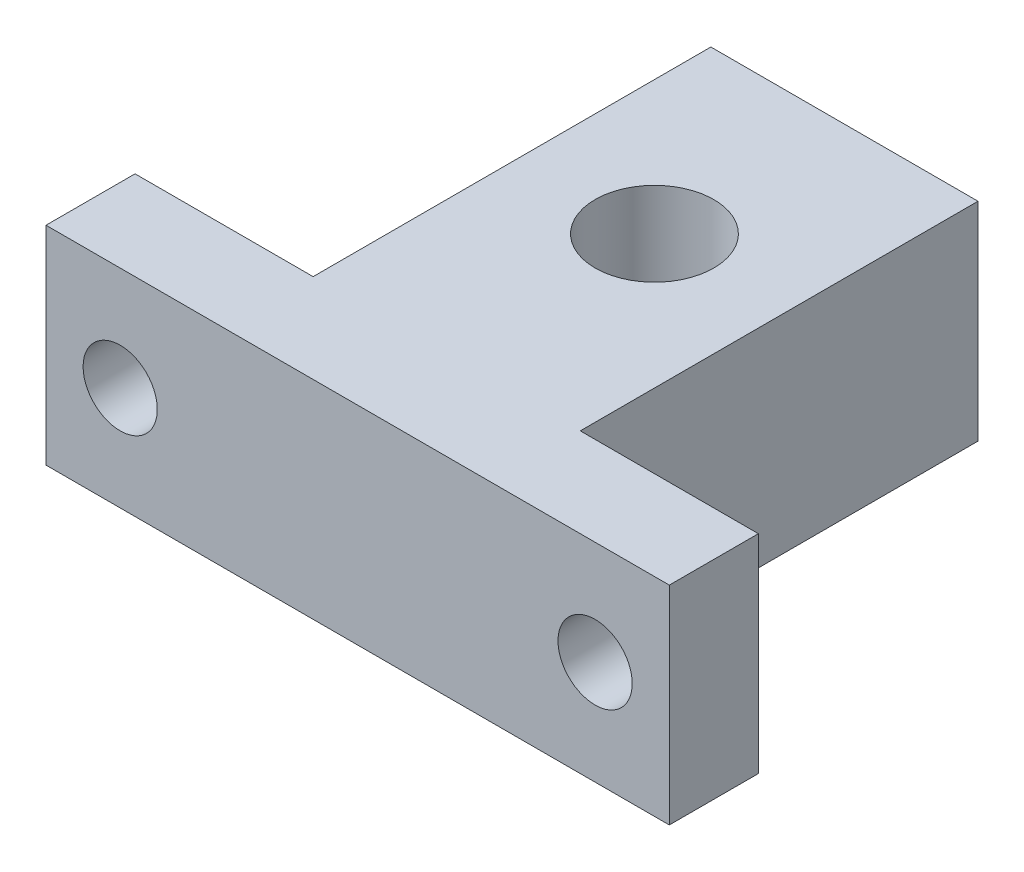
from build123d import *

# Parameters (mm, degrees)
SKETCH_1_W          = 18
SKETCH_1_H          = 26.8
SKETCH_1_R          = 4
SKETCH_1_W_2        = 12
SKETCH_1_H_2        = 6
EXTRUDE_1_DEPTH     = 14
SKETCH_2_R          = 2.5
CUT_EXTRUDE_1_DEPTH = 14


with BuildPart() as part:
    # 草图1 → 凸台-拉伸1 (new body)
    # profile 1 of 4: a face of its own
    with BuildSketch(Plane(origin=(0, 0, 0), x_dir=(1, 0, 0), z_dir=(0, 1, 0))):
        with Locations((0, -0.6)):
            Rectangle(SKETCH_1_W, SKETCH_1_H)
        with Locations(Location((0, 0, 0), (0, 0, 270))):
            Circle(SKETCH_1_R, mode=Mode.SUBTRACT)
    # profile 2 of 4: a face of its own
    with BuildSketch(Plane(origin=(0, 0, 0), x_dir=(1, 0, 0), z_dir=(0, 1, 0))):
        with Locations((15, -17)):
            Rectangle(SKETCH_1_W_2, SKETCH_1_H_2)
    # profile 3 of 4: a face of its own
    with BuildSketch(Plane(origin=(0, 0, 0), x_dir=(1, 0, 0), z_dir=(0, 1, 0))):
        with Locations((0, -17)):
            Rectangle(SKETCH_1_W, SKETCH_1_H_2)
    # profile 4 of 4: a face of its own
    with BuildSketch(Plane(origin=(0, 0, 0), x_dir=(1, 0, 0), z_dir=(0, 1, 0))):
        with Locations((-15, -17)):
            Rectangle(SKETCH_1_W_2, SKETCH_1_H_2)
    extrude(amount=EXTRUDE_1_DEPTH)

    # 草图2 → 切除-拉伸1 (cut)
    with BuildSketch(Plane(origin=(0, 0, 14), x_dir=(-1, 0, 0), z_dir=(0, 0, -1))):
        with Locations((-16, 7)):
            Circle(SKETCH_2_R)
        with Locations((16, 7)):
            Circle(SKETCH_2_R)
    extrude(amount=-CUT_EXTRUDE_1_DEPTH, mode=Mode.SUBTRACT)


solid = part.part
